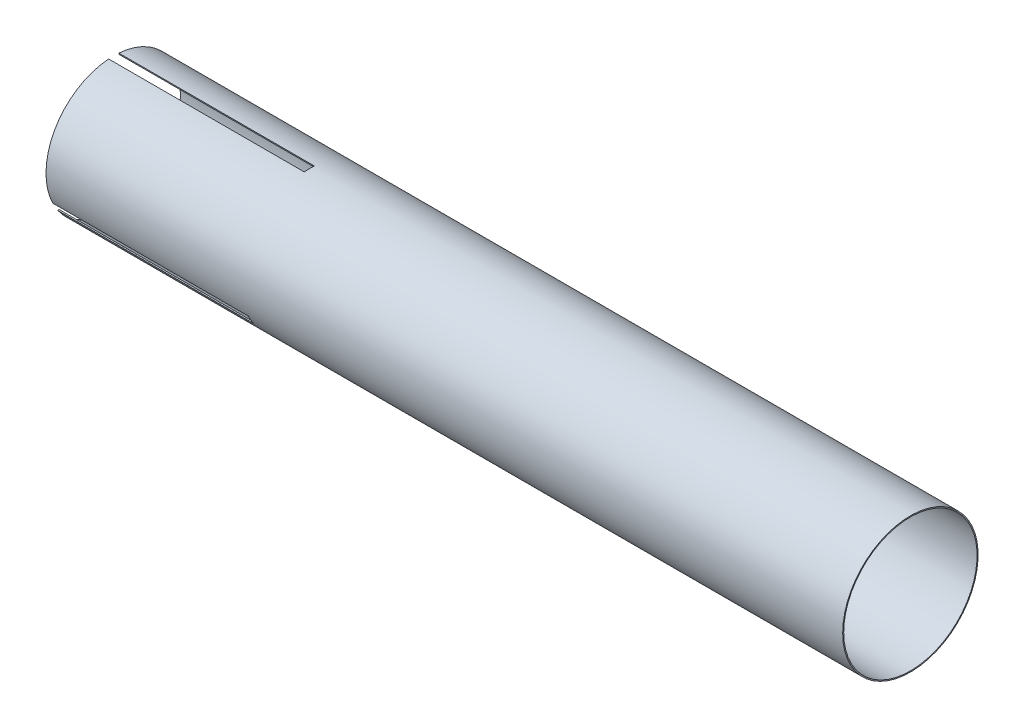
from build123d import *

# Parameters (mm, degrees)
ESQUISSE1_W                  = 896
ESQUISSE1_H                  = 1.182
ESQUISSE2_W                  = 220
ESQUISSE2_H                  = 11.482
ENL_V_MAT_EXTRU_1_DEPTH      = 903.454095369
R_P_TITION_CIRCULAIRE1_COUNT = 3
R_P_TITION_CIRCULAIRE1_ANGLE = 240


with BuildPart() as part:
    # Esquisse1 → Révolution1 (revolve)
    with BuildSketch(Plane.XY, mode=Mode.PRIVATE) as r_volution1_sk:
        with Locations((448, 75.591)):
            Rectangle(ESQUISSE1_W, ESQUISSE1_H)
    revolve(r_volution1_sk.sketch.rotate(Axis((0, 0, 0), (1, 0, 0)), 90), axis=Axis((0, 0, 0), (1, 0, 0)))

    # Esquisse2 → Enlèv. mat.-Extru.1 (cut, through all)
    with BuildSketch(Plane(origin=(0, 0, 0), x_dir=(1, 0, 0), z_dir=(0, 1, 0))):
        with Locations((110, 0)):
            Rectangle(ESQUISSE2_W, ESQUISSE2_H)
    enl_v_mat_extru_1 = extrude(amount=ENL_V_MAT_EXTRU_1_DEPTH, mode=Mode.SUBTRACT)

    # Répétition circulaire1: Enlèv. mat.-Extru.1 ×3 about axis
    r_p_tition_circulaire1_axis = Axis((0, 0, 0), (-1, 0, 0))
    for i in range(1, R_P_TITION_CIRCULAIRE1_COUNT):
        add(enl_v_mat_extru_1.rotate(r_p_tition_circulaire1_axis, i * R_P_TITION_CIRCULAIRE1_ANGLE / (R_P_TITION_CIRCULAIRE1_COUNT - 1)), mode=Mode.SUBTRACT)


solid = part.part
